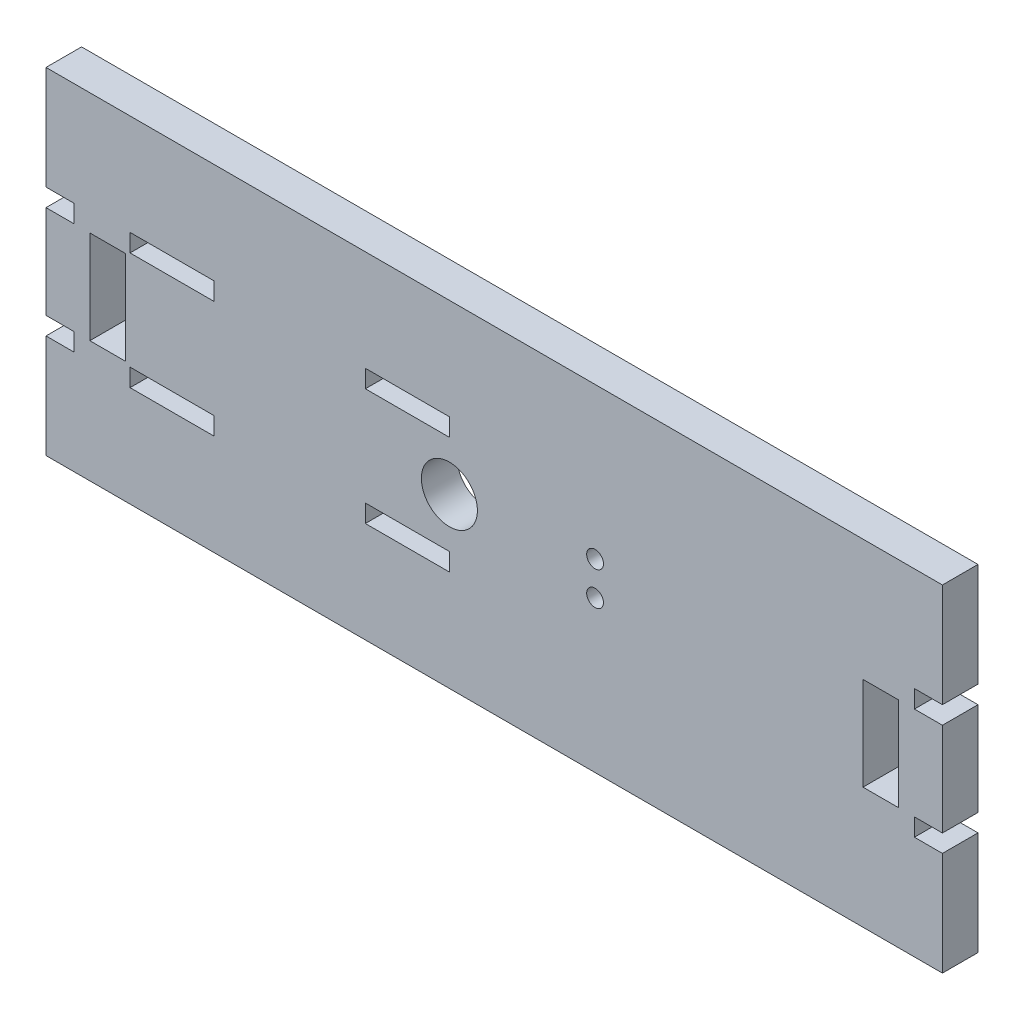
from build123d import *

# Parameters (mm, degrees)
SKETCH1_R           = 5
SKETCH1_R_2         = 1.5
SKETCH1_W           = 15
SKETCH1_H           = 3.175
SKETCH1_W_2         = 6.35
SKETCH1_H_2         = 16.66
BOSS_EXTRUDE1_DEPTH = 6.35


with BuildPart() as part:
    # Sketch1 → Boss-Extrude1 (new body)
    with BuildSketch(Plane.XY):
        Polygon((160, 0), (160, 18.5075), (155, 18.5075), (155, 21.6575), (160, 21.6575), (160, 38.3175), (155, 38.3175), (155, 41.4925), (160, 41.4925), (160, 60), (0, 60), (0, 41.505), (5, 41.505), (5, 38.33), (0, 38.33), (0, 21.67), (5, 21.67), (5, 18.495), (0, 18.495), (0, 0), align=None)
        with Locations((72, 30)):
            Circle(SKETCH1_R, mode=Mode.SUBTRACT)
        with Locations((98, 27)):
            Circle(SKETCH1_R_2, mode=Mode.SUBTRACT)
        with Locations((98, 33)):
            Circle(SKETCH1_R_2, mode=Mode.SUBTRACT)
        with Locations((64.5, 19.5875)):
            Rectangle(SKETCH1_W, SKETCH1_H, mode=Mode.SUBTRACT)
        with Locations((64.5, 40.4125)):
            Rectangle(SKETCH1_W, SKETCH1_H, mode=Mode.SUBTRACT)
        with Locations((22.5, 40.4125)):
            Rectangle(SKETCH1_W, SKETCH1_H, mode=Mode.SUBTRACT)
        with Locations((11.000000297, 30)):
            Rectangle(SKETCH1_W_2, SKETCH1_H_2, mode=Mode.SUBTRACT)
        with Locations((148.999999703, 29.9875)):
            Rectangle(SKETCH1_W_2, SKETCH1_H_2, mode=Mode.SUBTRACT)
        with Locations((22.5, 19.5875)):
            Rectangle(SKETCH1_W, SKETCH1_H, mode=Mode.SUBTRACT)
    extrude(amount=BOSS_EXTRUDE1_DEPTH)


solid = part.part
